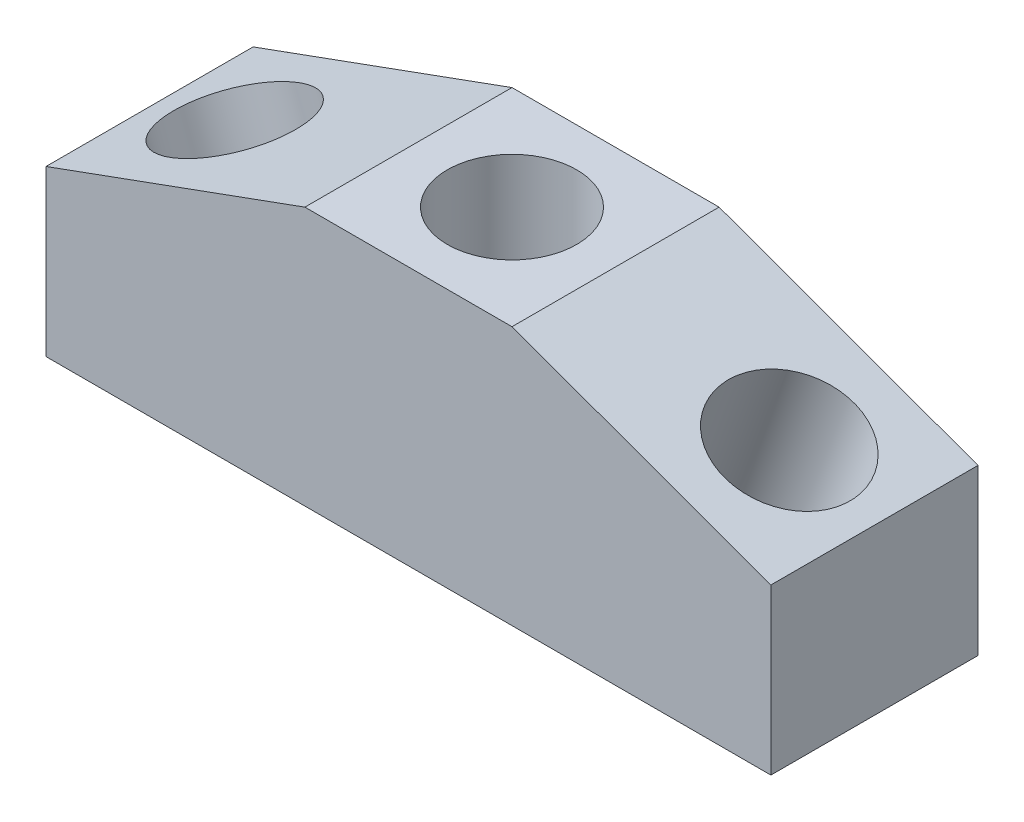
from build123d import *

# Parameters (mm, degrees)
EXTRUDE_1_DEPTH    = 8
HOLE_WIZARD_M6_1_D = 5
HOLE_WIZARD_M6_2_D = 5
HOLE_WIZARD_M6_3_D = 5


with BuildPart() as part:
    # 草图1 → 凸台-拉伸1 (new body)
    with BuildSketch(Plane.XY):
        Polygon((0, 0), (28, 0), (28, 6.360297657), (18, 10), (10, 10), (0, 6.360297657), align=None)
    extrude(amount=-EXTRUDE_1_DEPTH)

    # M6 螺纹孔1 (through all)
    with Locations(Plane(origin=(0, 10, 0), x_dir=(1, 0, 0), z_dir=(0, 1, 0))):
        with Locations((14, 4)):
            Hole(HOLE_WIZARD_M6_1_D / 2)

    # M6 螺纹孔2 (through all)
    with Locations(Plane(origin=(5.31953806, 14.615310703, 0), x_dir=(0.9396926207859093, -0.34202014332566627, 0), z_dir=(0.34202014332566627, 0.9396926207859093, 0))):
        with Locations((20.636043466, 4)):
            Hole(HOLE_WIZARD_M6_2_D / 2)

    # M6 螺纹孔3 (through all)
    with Locations(Plane(origin=(-2.044160264, 5.616284167, 0), x_dir=(0.9396926207859093, 0.3420201433256663, 0), z_dir=(-0.3420201433256663, 0.9396926207859093, 0))):
        with Locations((5.675349916, 4)):
            Hole(HOLE_WIZARD_M6_3_D / 2)


solid = part.part
